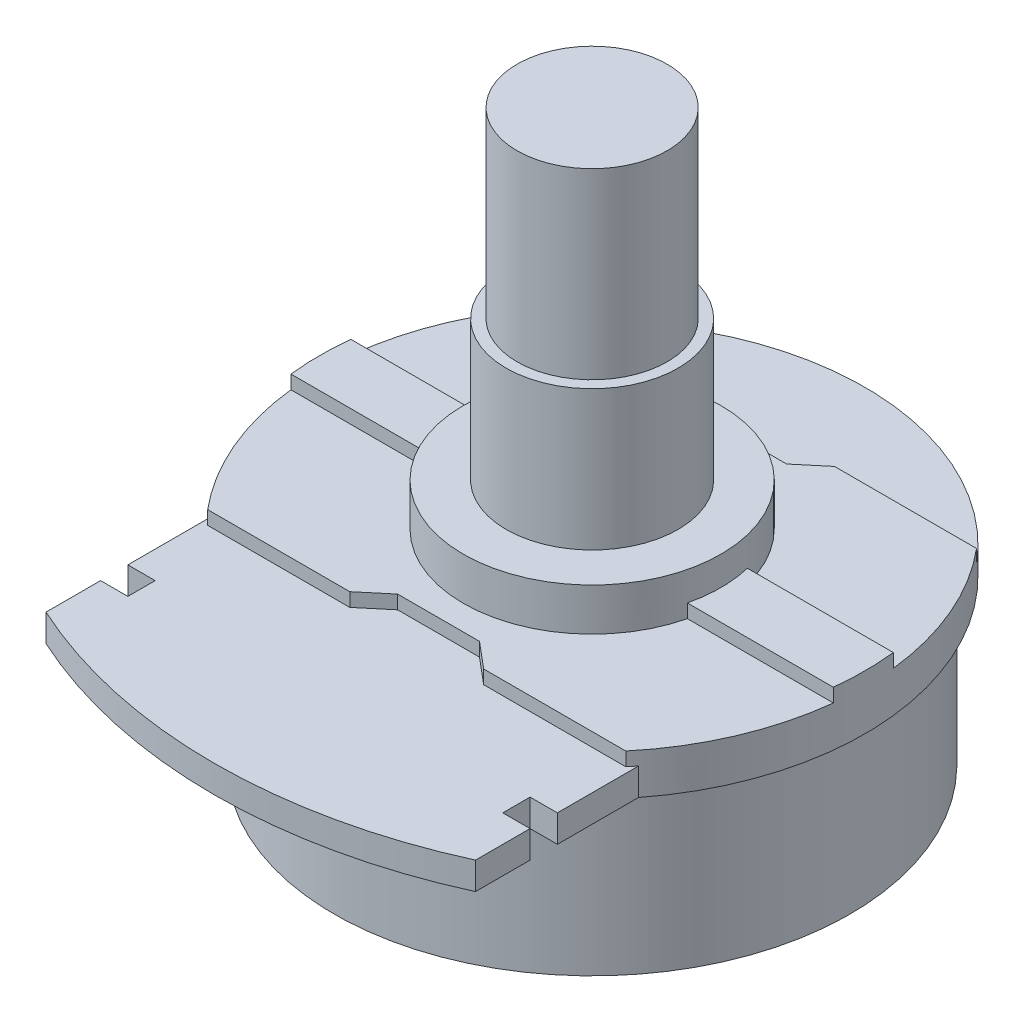
from build123d import *
from build123d.topology import SkipClean

# Parameters (mm, degrees)
SKETCH1_R           = 12.0015
BOSS_EXTRUDE1_DEPTH = 7.62
SKETCH2_R           = 12.7
BOSS_EXTRUDE2_DEPTH = 1.27
BOSS_EXTRUDE3_START = -1.27
BOSS_EXTRUDE3_DEPTH = 1.27
SKETCH4_R           = 5.9944
BOSS_EXTRUDE4_DEPTH = 2.6162
SKETCH5_R           = 4.0005
BOSS_EXTRUDE5_DEPTH = 6.5024
SKETCH6_R           = 3.4925
BOSS_EXTRUDE6_DEPTH = 8.509
BOSS_EXTRUDE7_DEPTH = 0.635
BOSS_EXTRUDE8_DEPTH = 0.635


with BuildPart() as part:
    # Sketch1 → Boss-Extrude1 (new body)
    with BuildSketch(Plane(origin=(0, 0, 0), x_dir=(1, 0, 0), z_dir=(0, 1, 0))):
        with Locations(Location((0, 0, 0), (0, 0, 90))):
            Circle(SKETCH1_R)
    extrude(amount=BOSS_EXTRUDE1_DEPTH)

    # Sketch2 → Boss-Extrude2 (add)
    with BuildSketch(Plane(origin=(0, 7.62, 0), x_dir=(1, 0, 0), z_dir=(0, 1, 0))):
        with Locations(Location((0, 0, 0), (0, 0, 270))):
            Circle(SKETCH2_R)
    extrude(amount=BOSS_EXTRUDE2_DEPTH)

    # Sketch3 → Boss-Extrude3 (add)
    with BuildSketch(Plane(origin=(0, 8.89, 0), x_dir=(1, 0, 0), z_dir=(0, 1, 0)).offset(BOSS_EXTRUDE3_START)):
        with BuildLine():
            ThreePointArc((9.9949, -7.835303057), (0, -12.7), (-9.9949, -7.835303057))
            Line((-9.9949, -7.835303057), (-9.9949, -11.612260807))
            Line((-9.9949, -11.612260807), (-8.7249, -11.612260807))
            Line((-8.7249, -11.612260807), (-8.7249, -12.882260807))
            Line((-8.7249, -12.882260807), (-9.9949, -12.882260807))
            Line((-9.9949, -12.882260807), (-9.9949, -15.422260807))
            ThreePointArc((-9.9949, -15.422260807), (0, -17.6022), (9.9949, -15.422260807))
            Line((9.9949, -15.422260807), (9.9949, -12.882260807))
            Line((9.9949, -12.882260807), (8.7249, -12.882260807))
            Line((8.7249, -12.882260807), (8.7249, -11.612260807))
            Line((8.7249, -11.612260807), (9.9949, -11.612260807))
            Line((9.9949, -11.612260807), (9.9949, -7.835303057))
        make_face()
    extrude(amount=BOSS_EXTRUDE3_DEPTH)

    # Sketch4 → Boss-Extrude4 (add)
    with BuildSketch(Plane(origin=(0, 8.89, 0), x_dir=(1, 0, 0), z_dir=(0, 1, 0))):
        with Locations(Location((0, 0, 0), (0, 0, 270))):
            Circle(SKETCH4_R)
    extrude(amount=BOSS_EXTRUDE4_DEPTH)

    # Sketch5 → Boss-Extrude5 (add)
    with BuildSketch(Plane(origin=(0, 11.5062, 0), x_dir=(1, 0, 0), z_dir=(0, 1, 0))):
        with Locations(Location((0, 0, 0), (0, 0, 270))):
            Circle(SKETCH5_R)
    extrude(amount=BOSS_EXTRUDE5_DEPTH)

    # Sketch6 → Boss-Extrude6 (add)
    with BuildSketch(Plane(origin=(0, 18.0086, 0), x_dir=(1, 0, 0), z_dir=(0, 1, 0))):
        with Locations(Location((0, 0, 0), (0, 0, 270))):
            Circle(SKETCH6_R)
    extrude(amount=BOSS_EXTRUDE6_DEPTH)

    # Sketch7 → Boss-Extrude7 (add)
    with SkipClean():  # the faces are left unmerged after this step: merging them gives an invalid solid
        with BuildSketch(Plane(origin=(0, 8.89, 0), x_dir=(1, 0, 0), z_dir=(0, 1, 0))):
            with BuildLine():
                Line((-9.728764428, 8.163402643), (-3.11582165, 8.163402643))
                Line((-3.11582165, 8.163402643), (-1.905, 7.147402643))
                Line((-1.905, 7.147402643), (1.905, 7.147402643))
                Line((1.905, 7.147402643), (3.11582165, 8.163402643))
                Line((3.11582165, 8.163402643), (9.728764428, 8.163402643))
                ThreePointArc((9.728764428, 8.163402643), (12.7, 0), (9.728764428, -8.163402643))
                Line((9.728764428, -8.163402643), (3.11582165, -8.163402643))
                Line((3.11582165, -8.163402643), (1.905, -7.147402643))
                Line((1.905, -7.147402643), (-1.905, -7.147402643))
                Line((-1.905, -7.147402643), (-3.11582165, -8.163402643))
                Line((-3.11582165, -8.163402643), (-9.728764428, -8.163402643))
                ThreePointArc((-9.728764428, -8.163402643), (-12.7, 0), (-9.728764428, 8.163402643))
            make_face()
        extrude(amount=BOSS_EXTRUDE7_DEPTH)

    # Sketch8 → Boss-Extrude8 (add)
    with SkipClean():  # the faces are left unmerged after this step: merging them gives an invalid solid
        with BuildSketch(Plane(origin=(0, 9.525, 0), x_dir=(1, 0, 0), z_dir=(0, 1, 0))):
            with BuildLine():
                Line((-12.622931157, 1.397), (12.622931157, 1.397))
                ThreePointArc((12.622931157, 1.397), (12.7, 0), (12.622931157, -1.397))
                Line((12.622931157, -1.397), (-12.622931157, -1.397))
                ThreePointArc((-12.622931157, -1.397), (-12.7, 0), (-12.622931157, 1.397))
            make_face()
        extrude(amount=BOSS_EXTRUDE8_DEPTH)


solid = part.part
